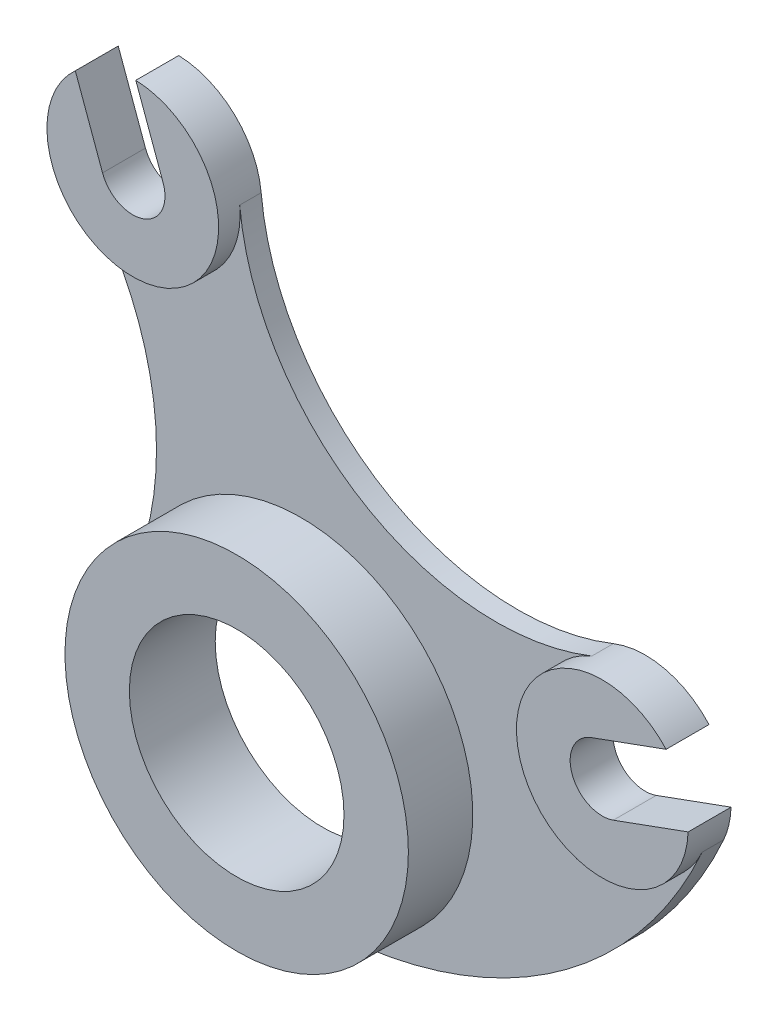
from build123d import *

# Parameters (mm, degrees)
BOSS_EXTRUDE1_DEPTH = 6.35
BOSS_EXTRUDE2_DEPTH = 12.7
SKETCH1_4_R         = 31.75
BOSS_EXTRUDE3_DEPTH = 25.4


with BuildPart() as part:
    # Sketch1 → Boss-Extrude1 (new body)
    with BuildSketch(Plane.XY):
        with BuildLine():
            ThreePointArc((72.649235075, 31.372352915), (4.684377865, 37.027544064), (-31.532761281, 94.816140123))
            ThreePointArc((-31.532761281, 94.816140123), (-47.103439421, 68.915388021), (-76.423524765, 76.238472936))
            ThreePointArc((-76.423524765, 76.238472936), (-57.493211559, 35.124721846), (-61.259500498, -9.980847149))
            ThreePointArc((-61.259500498, -9.980847149), (-4.767373791, 23.108705876), (37.42041065, -26.955949752))
            ThreePointArc((37.42041065, -26.955949752), (21.901301878, -63.505897962), (-15.174026915, -77.724246886))
            ThreePointArc((-15.174026915, -77.724246886), (56.54324661, -58.54842731), (105.288459403, -2.557502975))
            ThreePointArc((105.288459403, -2.557502975), (63.787892957, -9.815690456), (72.649235075, 31.372352915))
        make_face()
    extrude(amount=BOSS_EXTRUDE1_DEPTH)

    # Sketch1<3> → Boss-Extrude2 (add)
    with BuildSketch(Plane.XY):
        with BuildLine():
            Line((-55.91892877, 117.769161654), (-47.865575339, 95.642754953))
            ThreePointArc((-47.865575339, 95.642754953), (-53.558405687, 83.434440874), (-65.766719765, 89.127271222))
            Line((-65.766719765, 89.127271222), (-73.820073196, 111.253677924))
            ThreePointArc((-73.820073196, 111.253677924), (-48.128835912, 68.516820519), (-55.91892877, 117.769161654))
        make_face()
        with BuildLine():
            ThreePointArc((100.961845758, 24.797222453), (58.224988354, -0.894014831), (107.477329489, 6.896078027))
            Line((107.477329489, 6.896078027), (85.350922787, -1.157275404))
            ThreePointArc((85.350922787, -1.157275404), (73.142608709, 4.535554944), (78.835439057, 16.743869022))
            Line((78.835439057, 16.743869022), (100.961845758, 24.797222453))
        make_face()
    extrude(amount=BOSS_EXTRUDE2_DEPTH)

    # Sketch1<4> → Boss-Extrude3 (add)
    with BuildSketch(Plane.XY):
        with BuildLine():
            ThreePointArc((37.42041065, -26.955949752), (-4.767373791, 23.108705876), (-61.259500498, -9.980847149))
            ThreePointArc((-61.259500498, -9.980847149), (-55.381699797, -55.529761504), (-15.174026915, -77.724246886))
            ThreePointArc((-15.174026915, -77.724246886), (21.901301878, -63.505897962), (37.42041065, -26.955949752))
        make_face()
        with Locations((-13.37958935, -26.955949752)):
            Circle(SKETCH1_4_R, mode=Mode.SUBTRACT)
    extrude(amount=BOSS_EXTRUDE3_DEPTH)


solid = part.part
